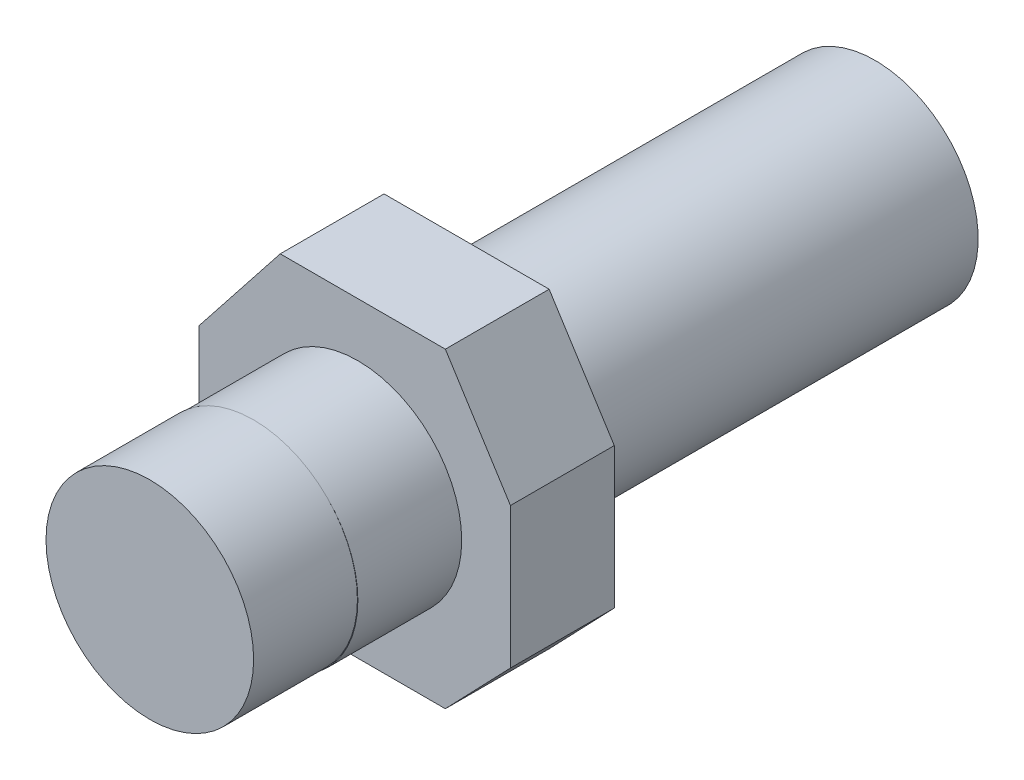
from build123d import *

# Parameters (mm, degrees)
BOSS_EXTRUDE1_DEPTH = 10
SKETCH2_R           = 10
BOSS_EXTRUDE2_DEPTH = 10
SKETCH3_R           = 10
BOSS_EXTRUDE3_DEPTH = 10
SKETCH4_R           = 9.92496084
BOSS_EXTRUDE4_DEPTH = 40


with BuildPart() as part:
    # Sketch1 → Boss-Extrude1 (new body)
    with BuildSketch(Plane.XY):
        Polygon((3.215110596, 16.166425121), (19.120786924, 16.166425121), (25.392646828, 6.257971014), (25.392646828, -7.300966184), (19.120786924, -13.833574879), (3.215110596, -13.833574879), (-4.607353172, -7.300966184), (-4.607353172, 6.257971014), align=None)
    extrude(amount=BOSS_EXTRUDE1_DEPTH)

    # Sketch2 → Boss-Extrude2 (add)
    with BuildSketch(Plane.XY.offset(10)):
        with Locations((10.695865166, 0.993157499)):
            Circle(SKETCH2_R)
    extrude(amount=BOSS_EXTRUDE2_DEPTH)

    # Sketch3 → Boss-Extrude3 (add)
    with BuildSketch(Plane.XY.offset(20)):
        with Locations(Location((10.65254826, 1.036474405, 0), (0, 0, 225.1754954))):
            Circle(SKETCH3_R)
    extrude(amount=BOSS_EXTRUDE3_DEPTH)

    # Sketch4 → Boss-Extrude4 (add)
    with BuildSketch(Plane(origin=(0, 0, 0), x_dir=(-1, 0, 0), z_dir=(0, 0, -1))):
        with Locations((-10.522597544, 1.036474405)):
            Circle(SKETCH4_R)
    extrude(amount=BOSS_EXTRUDE4_DEPTH)


solid = part.part
